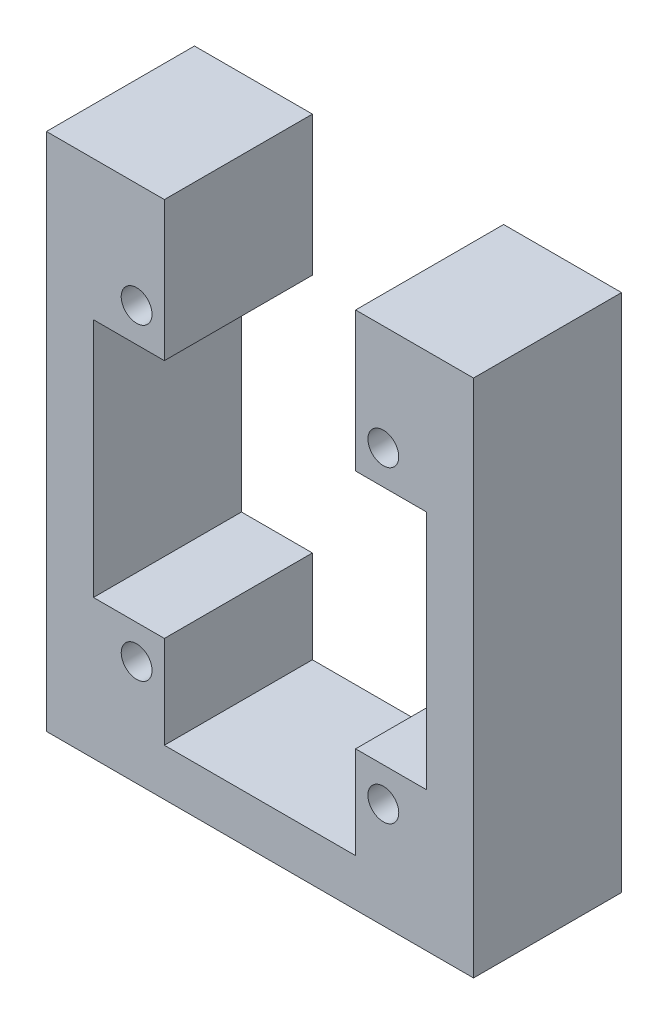
from build123d import *

# Parameters (mm, degrees)
SKETCH1_W           = 34.62
SKETCH1_H           = 42.12
SKETCH1_W_2         = 27
SKETCH1_H_2         = 34.5
BOSS_EXTRUDE1_DEPTH = 12
SKETCH2_W           = 5.75
SKETCH2_H           = 7.5
SKETCH2_R           = 1.25
BOSS_EXTRUDE2_DEPTH = 12
SKETCH3_W           = 15.5
SKETCH3_H           = 3.81
CUT_EXTRUDE1_DEPTH  = 30.785226204


with BuildPart() as part:
    # Sketch1 → Boss-Extrude1 (new body)
    with BuildSketch(Plane.XY):
        Rectangle(SKETCH1_W, SKETCH1_H)
        Rectangle(SKETCH1_W_2, SKETCH1_H_2, mode=Mode.SUBTRACT)
    extrude(amount=BOSS_EXTRUDE1_DEPTH)

    # Sketch2 → Boss-Extrude2 (add, through all)
    # profile 1 of 4: a face of its own
    with BuildSketch(Plane(origin=(0, 0, 0), x_dir=(-1, 0, 0), z_dir=(0, 0, -1))):
        with Locations((-10.625, 13.5)):
            Rectangle(SKETCH2_W, SKETCH2_H)
        with Locations((-10, 12.5)):
            Circle(SKETCH2_R, mode=Mode.SUBTRACT)
    # profile 2 of 4: a face of its own
    with BuildSketch(Plane(origin=(0, 0, 0), x_dir=(-1, 0, 0), z_dir=(0, 0, -1))):
        with Locations((10.625, 13.5)):
            Rectangle(SKETCH2_W, SKETCH2_H)
        with Locations(Location((10, 12.5, 0), (0, 0, 180))):
            Circle(SKETCH2_R, mode=Mode.SUBTRACT)
    # profile 3 of 4: a face of its own
    with BuildSketch(Plane(origin=(0, 0, 0), x_dir=(-1, 0, 0), z_dir=(0, 0, -1))):
        with Locations((10.625, -13.5)):
            Rectangle(SKETCH2_W, SKETCH2_H)
        with Locations((10, -12.5)):
            Circle(SKETCH2_R, mode=Mode.SUBTRACT)
    # profile 4 of 4: a face of its own
    with BuildSketch(Plane(origin=(0, 0, 0), x_dir=(-1, 0, 0), z_dir=(0, 0, -1))):
        with Locations((-10.625, -13.5)):
            Rectangle(SKETCH2_W, SKETCH2_H)
        with Locations(Location((-10, -12.5, 0), (0, 0, 180))):
            Circle(SKETCH2_R, mode=Mode.SUBTRACT)
    extrude(amount=-BOSS_EXTRUDE2_DEPTH)

    # Sketch3 → Cut-Extrude1 (cut, through all)
    with BuildSketch(Plane(origin=(0, 0, 0), x_dir=(-1, 0, 0), z_dir=(0, 0, -1))):
        with Locations((0, 19.155)):
            Rectangle(SKETCH3_W, SKETCH3_H)
    extrude(amount=-CUT_EXTRUDE1_DEPTH, mode=Mode.SUBTRACT)


solid = part.part
